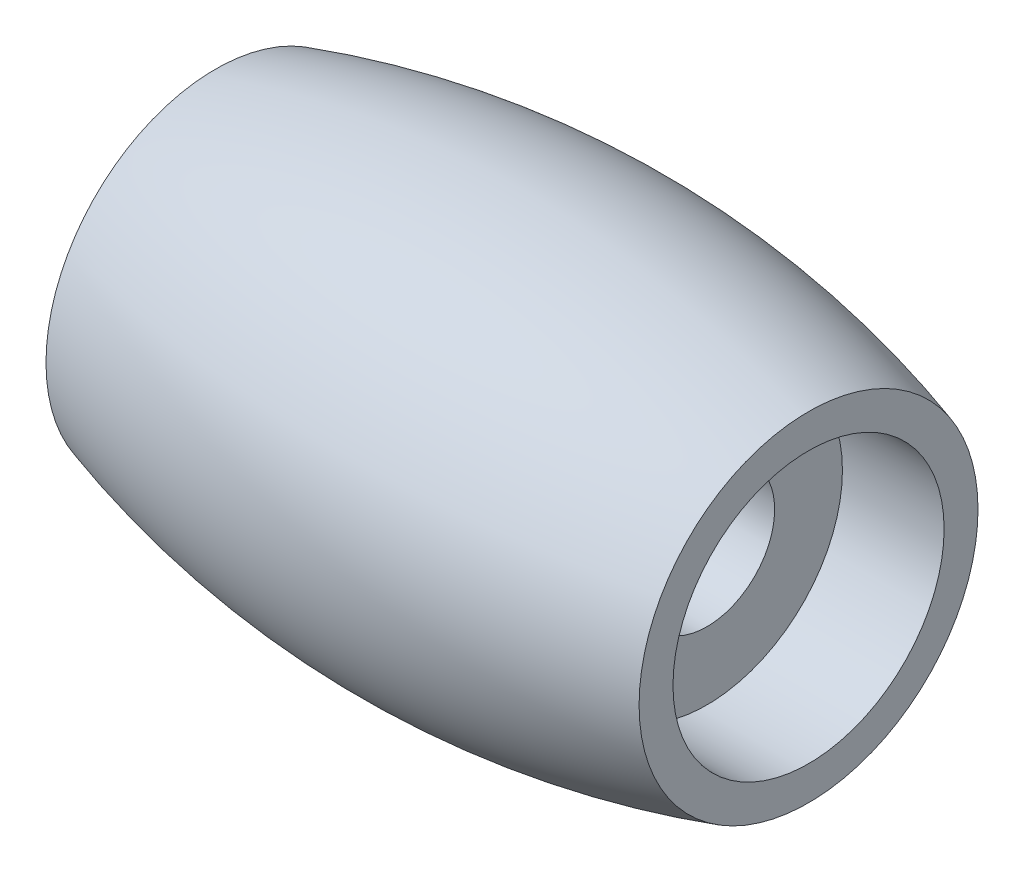
from build123d import *


with BuildPart() as part:
    # Sketch2 → Revolve1 (revolve)
    with BuildSketch(Plane.XY, mode=Mode.PRIVATE) as revolve1_sk:
        with BuildLine():
            Line((-2.875, 1), (2.875, 1))
            Line((2.875, 1), (2.875, 2))
            Line((2.875, 2), (4.375, 2))
            Line((4.375, 2), (4.375, 2.5))
            ThreePointArc((4.375, 2.5), (0, 3.152199646), (-4.375, 2.5))
            Line((-4.375, 2.5), (-4.375, 2))
            Line((-4.375, 2), (-2.875, 2))
            Line((-2.875, 2), (-2.875, 1))
        make_face()
    revolve(revolve1_sk.sketch.rotate(Axis((-8.91796875, 0, 0), (1, 0, 0)), 90), axis=Axis((-8.91796875, 0, 0), (1, 0, 0)))


solid = part.part
